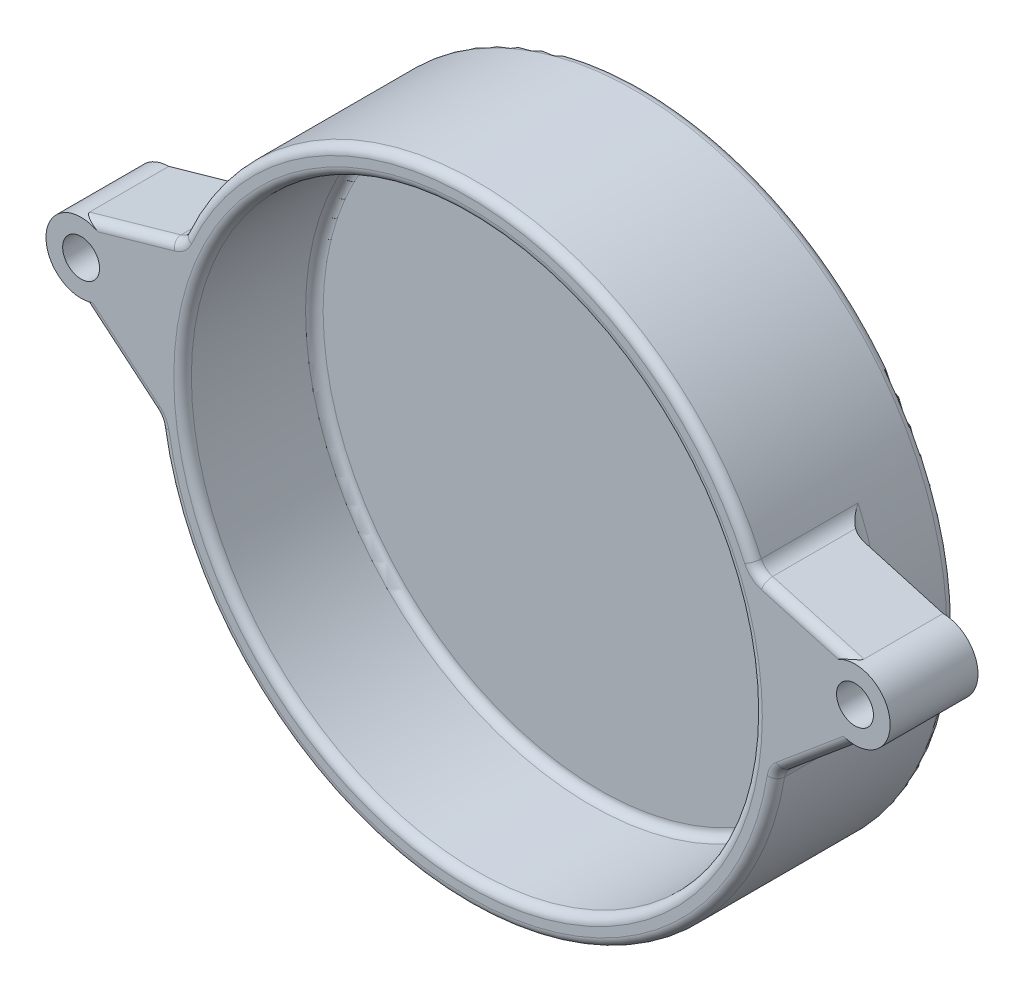
from build123d import *

# Parameters (mm, degrees)
SKETCH1_R           = 35.5
SKETCH1_R_2         = 32.5
BOSS_EXTRUDE1_DEPTH = 20
SKETCH2_R           = 35.5
BOSS_EXTRUDE2_DEPTH = 5
BOSS_EXTRUDE5_START = -10
BOSS_EXTRUDE5_DEPTH = 10
SKETCH6_R           = 2.1
CUT_EXTRUDE1_DEPTH  = 10
FILLET1_R           = 2
FILLET2_R           = 1


with BuildPart() as part:
    # Sketch1 → Boss-Extrude1 (new body)
    with BuildSketch(Plane.XY):
        Circle(SKETCH1_R)
        Circle(SKETCH1_R_2, mode=Mode.SUBTRACT)
    extrude(amount=BOSS_EXTRUDE1_DEPTH)

    # Sketch2 → Boss-Extrude2 (add)
    with BuildSketch(Plane(origin=(0, 0, 0), x_dir=(-1, 0, 0), z_dir=(0, 0, -1))):
        with Locations(Location((0, 0, 0), (0, 0, 180))):
            Circle(SKETCH2_R)
    extrude(amount=-BOSS_EXTRUDE2_DEPTH)

    # Sketch5 → Boss-Extrude5 (add)
    with BuildSketch(Plane.XY.offset(20).offset(BOSS_EXTRUDE5_START)):
        with BuildLine():
            Line((-44.01983555, 2.462594057), (-35.152395855, -4.955710406))
            ThreePointArc((-35.152395855, -4.955710406), (-35.21119146, 4.519070252), (-32.761689436, 13.671931294))
            Line((-32.761689436, 13.671931294), (-44.080202136, 10.462366296))
            ThreePointArc((-44.080202136, 10.462366296), (-48.049904962, 6.432296883), (-44.01983555, 2.462594057))
        make_face()
        with BuildLine():
            Line((44.080202136, 10.462366296), (32.761689436, 13.671931294))
            ThreePointArc((32.761689436, 13.671931294), (35.21119146, 4.519070252), (35.152395855, -4.955710406))
            Line((35.152395855, -4.955710406), (44.01983555, 2.462594057))
            ThreePointArc((44.01983555, 2.462594057), (48.049904962, 6.432296883), (44.080202136, 10.462366296))
        make_face()
    extrude(amount=BOSS_EXTRUDE5_DEPTH)

    # Sketch6 → Cut-Extrude1 (cut)
    with BuildSketch(Plane(origin=(0, 0, 10), x_dir=(-1, 0, 0), z_dir=(0, 0, -1))):
        with Locations((-44.050018843, 6.462480176)):
            Circle(SKETCH6_R)
        with Locations((44.050018843, 6.462480176)):
            Circle(SKETCH6_R)
    extrude(amount=-CUT_EXTRUDE1_DEPTH, mode=Mode.SUBTRACT)

    # Fillet1
    fillet1_edges = [part.edges().sort_by_distance(p)[0] for p in [
        (-35.21119146, 4.519070252, 10),
        (-32.761689436, 13.671931294, 15),
        (-35.152395855, -4.955710406, 15),
        (34.808691264, 6.971729521, 10),
        (35.152395855, -4.955710406, 15),
        (32.761689436, 13.671931294, 15),
    ]]
    fillet(fillet1_edges, radius=FILLET1_R)

    # Fillet2
    fillet2_edges = [part.edges().sort_by_distance(p)[0] for p in [
        (-32.5, 0, 5),
        (-35.5, 0, 0),
        (-39.876382255, -1.003727579, 20),
        (38.877374536, 11.937720328, 20),
        (0, -35.5, 20),
        (0, 35.5, 20),
        (-32.5, 0, 20),
        (-38.877374536, 11.937720328, 20),
        (39.876382255, -1.003727579, 20),
        (-35.278088778, -5.014669945, 20),
        (-32.912138626, 13.824247135, 20),
        (32.912138626, 13.824247135, 20),
        (35.278088778, -5.014669945, 20),
    ]]
    fillet(fillet2_edges, radius=FILLET2_R)


solid = part.part
